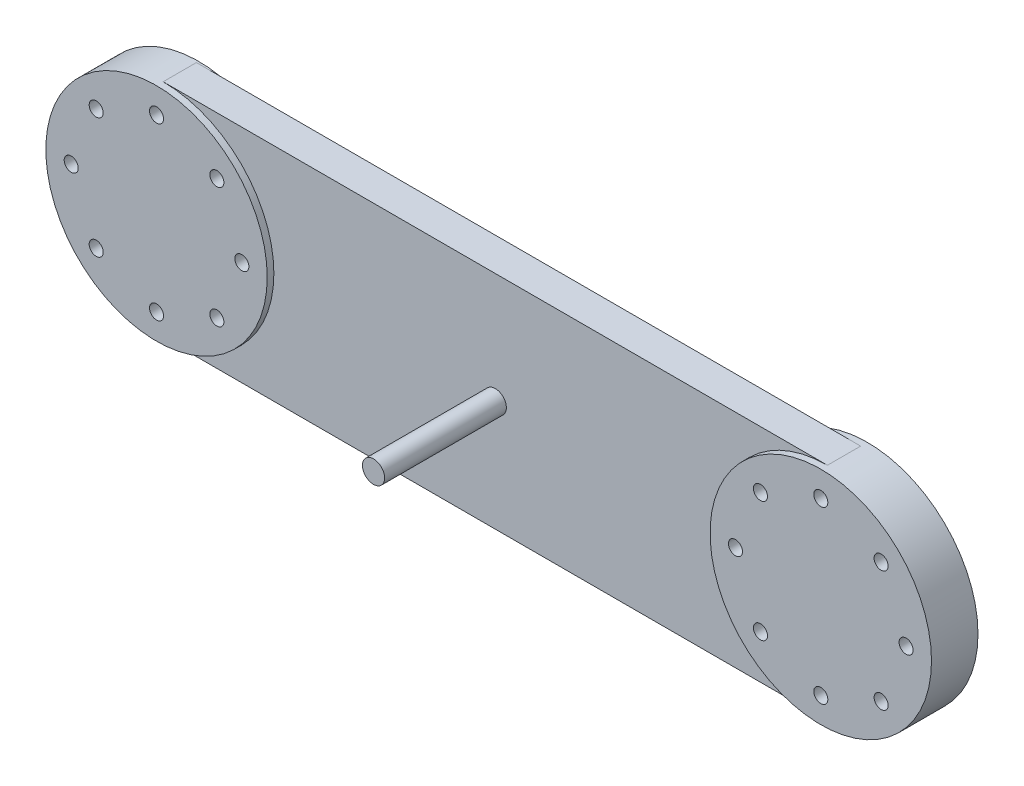
from build123d import *

# Parameters (mm, degrees)
SKETCH_1_R               = 50
EXTRUDE_18_DEPTH         = 13
EXTRUDE_18_2_DEPTH       = 13
SKETCH_1_28_W            = 300
SKETCH_1_28_H            = 100
EXTRUDE_21_DEPTH         = 15
SKETCH_1_30_R            = 5
EXTRUDE_22_DEPTH         = 70
SKETCH_1_31_R            = 50
CUT_EXTRUDE_2_DEPTH      = 41
EXTRUDE_23_DEPTH         = 18
EXTRUDE_23_DEPTH_BACK    = 1
SKETCH_1_32_R            = 50
SKETCH_1_33_R            = 6.5
CUT_EXTRUDE_3_DEPTH      = 242.8
CUT_EXTRUDE_5_DEPTH      = 130
CUT_EXTRUDE_5_DEPTH_BACK = 69
SKETCH_1_35_R            = 3.175
SKETCH_1_36_R            = 50
CUT_EXTRUDE_6_DEPTH      = 34
EXTRUDE_24_DEPTH         = 18
EXTRUDE_24_DEPTH_BACK    = 3
SKETCH_1_37_R            = 50
CUT_EXTRUDE_7_DEPTH      = 87
CUT_EXTRUDE_7_DEPTH_BACK = 98
SKETCH_1_41_R            = 3.175


with BuildPart() as part:
    # 草图1 → 凸台-拉伸18 (new body)
    with BuildSketch(Plane.XY):
        with Locations((0, 50)):
            Circle(SKETCH_1_R)
    extrude(amount=EXTRUDE_18_DEPTH)



with BuildPart() as body_2:
    # 草图1 → Extrude 18 2 (new body)
    with BuildSketch(Plane.XY):
        with Locations((-300, 50)):
            Circle(SKETCH_1_R)
    extrude(amount=EXTRUDE_18_2_DEPTH)


with BuildPart() as part_1:
    add(part.part)

    add(body_2.part)  # 凸台-拉伸21 merges body 2
    # 草图1<28> → 凸台-拉伸21 (add)
    with BuildSketch(Plane.XY):
        with Locations((-150, 50)):
            Rectangle(SKETCH_1_28_W, SKETCH_1_28_H)
    extrude(amount=EXTRUDE_21_DEPTH)

    # 草图1<30> → 凸台-拉伸22 (add)
    with BuildSketch(Plane.XY):
        with Locations((-150, 50)):
            Circle(SKETCH_1_30_R)
    extrude(amount=EXTRUDE_22_DEPTH)

    # 草图1<31> → 切除-拉伸2 (cut)
    with BuildSketch(Plane.XY):
        with Locations((-300, 50)):
            Circle(SKETCH_1_31_R)
    extrude(amount=CUT_EXTRUDE_2_DEPTH, mode=Mode.SUBTRACT)

    # 草图1<32> → 凸台-拉伸23 (add, two sides: drawn at the far end of the back side and taken through both)
    with BuildSketch(Plane.XY.offset(-EXTRUDE_23_DEPTH_BACK)):
        with Locations((-300, 50)):
            Circle(SKETCH_1_32_R)
    extrude(amount=EXTRUDE_23_DEPTH + EXTRUDE_23_DEPTH_BACK)

    # 草图1<33> → 切除-拉伸3 (cut)
    with BuildSketch(Plane.XY):
        with Locations((0, 50)):
            Circle(SKETCH_1_33_R)
    extrude(amount=CUT_EXTRUDE_3_DEPTH, mode=Mode.SUBTRACT)

    # 草图1<35> → 切除-拉伸5 (cut, two sides: drawn at the far end of the back side and taken through both)
    with BuildSketch(Plane.XY.offset(-CUT_EXTRUDE_5_DEPTH_BACK)):
        with Locations((-261.469660941, 50)):
            Circle(SKETCH_1_35_R)
    extrude(amount=CUT_EXTRUDE_5_DEPTH + CUT_EXTRUDE_5_DEPTH_BACK, mode=Mode.SUBTRACT)

    # 草图1<36> → 切除-拉伸6 (cut)
    with BuildSketch(Plane.XY):
        with Locations((0, 50)):
            Circle(SKETCH_1_36_R)
    extrude(amount=CUT_EXTRUDE_6_DEPTH, mode=Mode.SUBTRACT)

    # 草图1<37> → 凸台-拉伸24 (add, two sides: drawn at the far end of the back side and taken through both)
    with BuildSketch(Plane.XY.offset(-EXTRUDE_24_DEPTH_BACK)):
        with Locations((0, 50)):
            Circle(SKETCH_1_37_R)
    extrude(amount=EXTRUDE_24_DEPTH + EXTRUDE_24_DEPTH_BACK)

    # 草图1<41> → 切除-拉伸7 (cut, two sides: drawn at the far end of the back side and taken through both)
    with BuildSketch(Plane.XY.offset(-CUT_EXTRUDE_7_DEPTH_BACK)):
        with Locations((0, 11.469660941)):
            Circle(SKETCH_1_41_R)
        with Locations((0, 88.530339059)):
            Circle(SKETCH_1_41_R)
        with Locations((-300, 11.469660941)):
            Circle(SKETCH_1_41_R)
        with Locations((-300, 88.530339059)):
            Circle(SKETCH_1_41_R)
        with Locations((-327.24506403, 22.75493597)):
            Circle(SKETCH_1_41_R)
        with Locations((-261.469660941, 50)):
            Circle(SKETCH_1_41_R)
        with Locations((-38.530339059, 50)):
            Circle(SKETCH_1_41_R)
        with Locations((-272.75493597, 22.75493597)):
            Circle(SKETCH_1_41_R)
        with Locations((-338.530339059, 50)):
            Circle(SKETCH_1_41_R)
        with Locations((-327.24506403, 77.24506403)):
            Circle(SKETCH_1_41_R)
        with Locations((-272.75493597, 77.24506403)):
            Circle(SKETCH_1_41_R)
        with Locations((-27.24506403, 77.24506403)):
            Circle(SKETCH_1_41_R)
        with Locations((27.24506403, 77.24506403)):
            Circle(SKETCH_1_41_R)
        with Locations((38.530339059, 50)):
            Circle(SKETCH_1_41_R)
        with Locations((27.24506403, 22.75493597)):
            Circle(SKETCH_1_41_R)
        with Locations((-27.24506403, 22.75493597)):
            Circle(SKETCH_1_41_R)
    extrude(amount=CUT_EXTRUDE_7_DEPTH + CUT_EXTRUDE_7_DEPTH_BACK, mode=Mode.SUBTRACT)


solid = part_1.part
